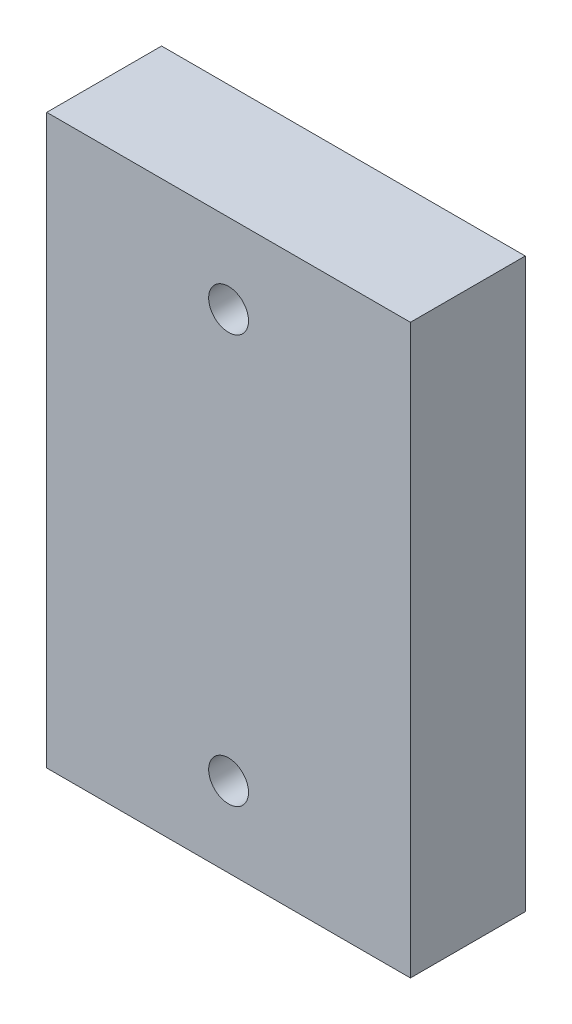
from build123d import *

# Parameters (mm, degrees)
SKETCH1_W           = 57.912
SKETCH1_H           = 90.424
BOSS_EXTRUDE1_DEPTH = 18.288
SKETCH2_R           = 3.175
CUT_EXTRUDE2_DEPTH  = 25.4


with BuildPart() as part:
    # Sketch1 → Boss-Extrude1 (new body)
    with BuildSketch(Plane.XY):
        with Locations((-74.103455126, -6.029946441)):
            Rectangle(SKETCH1_W, SKETCH1_H)
    extrude(amount=BOSS_EXTRUDE1_DEPTH)

    # Sketch2 → Cut-Extrude2 (cut)
    with BuildSketch(Plane.XY.offset(18.288)):
        with Locations((-74.103455126, 26.482053559)):
            Circle(SKETCH2_R)
        with Locations((-74.103455126, -38.541946441)):
            Circle(SKETCH2_R)
    extrude(amount=-CUT_EXTRUDE2_DEPTH, mode=Mode.SUBTRACT)


solid = part.part
